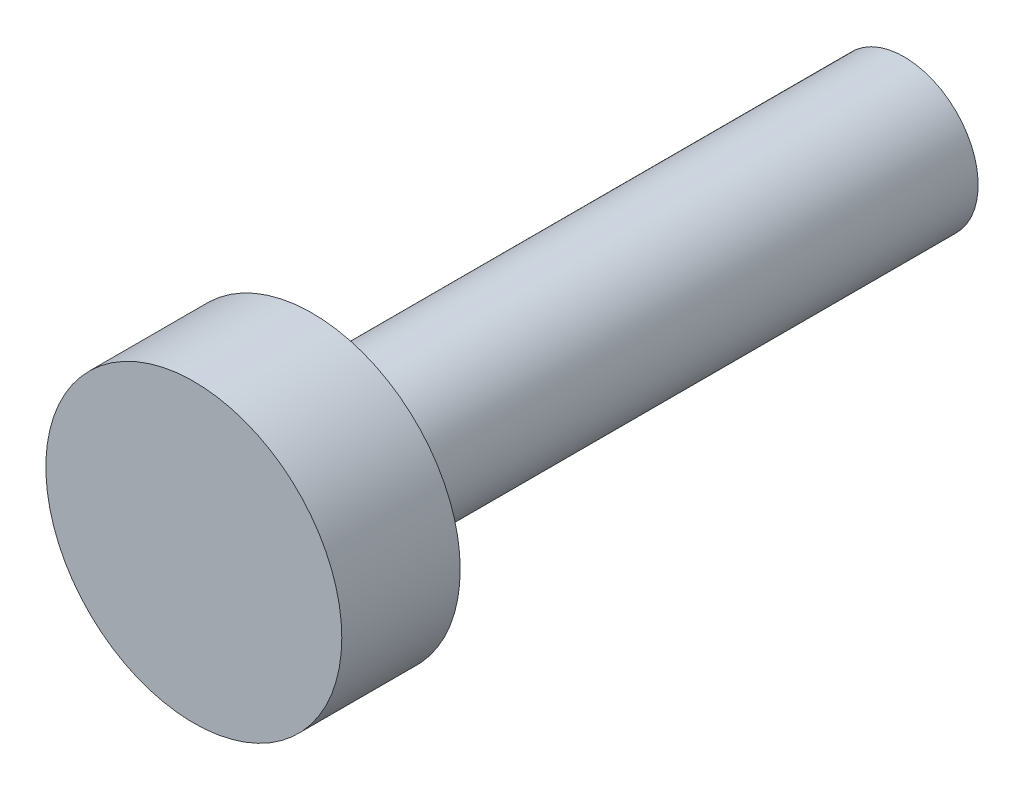
from build123d import *

# Parameters (mm, degrees)
ESQUISSE1_R        = 2
BOSS_EXTRU_1_DEPTH = 1.6
ESQUISSE2_R        = 1
BOSS_EXTRU_2_DEPTH = 8


with BuildPart() as part:
    # Esquisse1 → Boss.-Extru.1 (new body)
    with BuildSketch(Plane.XY):
        Circle(ESQUISSE1_R)
    extrude(amount=BOSS_EXTRU_1_DEPTH)

    # Esquisse2 → Boss.-Extru.2 (add)
    with BuildSketch(Plane(origin=(0, 0, 0), x_dir=(-1, 0, 0), z_dir=(0, 0, -1))):
        Circle(ESQUISSE2_R)
    extrude(amount=BOSS_EXTRU_2_DEPTH)


solid = part.part
